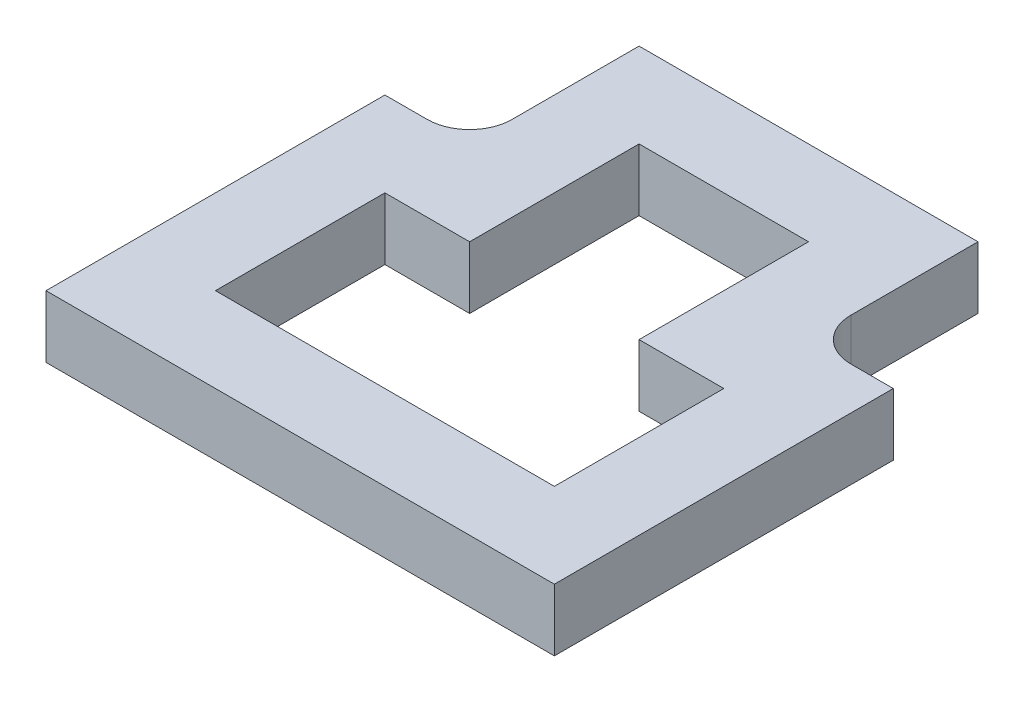
from build123d import *

# Parameters (mm, degrees)
CROQUIS1_W                = 30
CROQUIS1_H                = 30
SALIENTE_EXTRUIR1_DEPTH   = 3
CROQUIS2_W                = 15
CROQUIS2_H                = 30
SALIENTE_EXTRUIR3_DEPTH   = 3
SALIENTE_EXTRUIR3_2_DEPTH = 3
CROQUIS3_W                = 30
CROQUIS3_H                = 30
SALIENTE_EXTRUIR4_DEPTH   = 3
SALIENTE_EXTRUIR5_DEPTH   = 3
CORTAR_EXTRUIR1_DEPTH     = 6
SALIENTE_EXTRUIR8_DEPTH   = 11
CROQUIS7_W                = 30
CROQUIS7_H                = 3.175
CORTAR_EXTRUIR3_DEPTH     = 18.542
CROQUIS9_W                = 60
CROQUIS9_H                = 0.175
SALIENTE_EXTRUIR9_DEPTH   = 11
CROQUIS10_W               = 90
CROQUIS10_H               = 5
CORTAR_EXTRUIR5_DEPTH     = 93
CROQUIS11_W               = 30
CROQUIS11_H               = 3.175
SALIENTE_EXTRUIR10_DEPTH  = 11
CROQUIS12_W               = 60
CROQUIS12_H               = 0.175
CORTAR_EXTRUIR6_DEPTH     = 11
CROQUIS13_W               = 30
CROQUIS13_H               = 5
CORTAR_EXTRUIR7_DEPTH     = 10
SALIENTE_EXTRUIR11_DEPTH  = 5


with BuildPart() as part:
    # Croquis1 → Saliente-Extruir1 (new body)
    with BuildSketch(Plane(origin=(0, 0, 0), x_dir=(1, 0, 0), z_dir=(0, 1, 0))):
        Rectangle(CROQUIS1_W, CROQUIS1_H)
    extrude(amount=SALIENTE_EXTRUIR1_DEPTH)



with BuildPart() as body_2:
    # Croquis2 → Saliente-Extruir3 (new body)
    with BuildSketch(Plane(origin=(0, 3, 0), x_dir=(1, 0, 0), z_dir=(0, 1, 0))):
        with Locations((-22.5, -30)):
            Rectangle(CROQUIS2_W, CROQUIS2_H)
    extrude(amount=-SALIENTE_EXTRUIR3_DEPTH)


with BuildPart() as body_3:
    # Croquis2 → Saliente-Extruir3 2 (new body)
    with BuildSketch(Plane(origin=(0, 3, 0), x_dir=(1, 0, 0), z_dir=(0, 1, 0))):
        with Locations((22.5, -30)):
            Rectangle(CROQUIS2_W, CROQUIS2_H)
    extrude(amount=-SALIENTE_EXTRUIR3_2_DEPTH)


with BuildPart() as part_1:
    add(part.part)

    add(body_2.part)  # Saliente-Extruir4 merges body 2

    add(body_3.part)  # Saliente-Extruir4 merges body 3
    # Croquis3 → Saliente-Extruir4 (add)
    with BuildSketch(Plane(origin=(0, 3, 0), x_dir=(1, 0, 0), z_dir=(0, 1, 0))):
        with Locations((0, -30)):
            Rectangle(CROQUIS3_W, CROQUIS3_H)
    extrude(amount=-SALIENTE_EXTRUIR4_DEPTH)

    # Croquis4 → Saliente-Extruir5 (add)
    with BuildSketch(Plane(origin=(0, 3, 0), x_dir=(1, 0, 0), z_dir=(0, 1, 0))):
        Polygon((-30, 0), (-45, 0), (-45, -60), (45, -60), (45, 0), (30, 0), (30, 30), (-30, 30), align=None)
    extrude(amount=SALIENTE_EXTRUIR5_DEPTH)

    # Croquis5 → Cortar-Extruir1 (cut)
    with BuildSketch(Plane(origin=(0, 0, 0), x_dir=(-1, 0, 0), z_dir=(0, -1, 0))):
        Polygon((30, -45), (30, -15), (15, -15), (15, 15), (-15, 15), (-15, -15), (-30, -15), (-30, -45), align=None)
    extrude(amount=-CORTAR_EXTRUIR1_DEPTH, mode=Mode.SUBTRACT)

    # Croquis6 → Saliente-Extruir8 (add)
    with BuildSketch(Plane(origin=(0, 3, 0), x_dir=(-1, 0, 0), z_dir=(0, -1, 0))):
        with BuildLine():
            Line((37.5, 0), (45, 0))
            Line((45, 0), (45, -60))
            Line((45, -60), (-45, -60))
            Line((-45, -60), (-45, 0))
            Line((-45, 0), (-37.5, 0))
            ThreePointArc((-37.5, 0), (-32.196699141, 2.196699141), (-30, 7.5))
            Line((-30, 7.5), (-30, 30))
            Line((-30, 30), (30, 30))
            Line((30, 30), (30, 7.5))
            ThreePointArc((30, 7.5), (32.196699141, 2.196699141), (37.5, 0))
        make_face()
        Polygon((15, 15), (15, -15), (30, -15), (30, -45), (-30, -45), (-30, -15), (-15, -15), (-15, 15), align=None, mode=Mode.SUBTRACT)
    extrude(amount=-SALIENTE_EXTRUIR8_DEPTH)

    # Croquis7 → Cortar-Extruir3 (cut)
    with BuildSketch(Plane(origin=(0, 14, 0), x_dir=(1, 0, 0), z_dir=(0, 1, 0))):
        with Locations((0, 16.5875)):
            Rectangle(CROQUIS7_W, CROQUIS7_H)
    extrude(amount=-CORTAR_EXTRUIR3_DEPTH, mode=Mode.SUBTRACT)

    # Croquis9 → Saliente-Extruir9 (add)
    with BuildSketch(Plane(origin=(0, 14, 0), x_dir=(1, 0, 0), z_dir=(0, 1, 0))):
        with Locations((0, 30.0875)):
            Rectangle(CROQUIS9_W, CROQUIS9_H)
    extrude(amount=-SALIENTE_EXTRUIR9_DEPTH)

    # Croquis10 → Cortar-Extruir5 (cut)
    with BuildSketch(Plane.XY.offset(60)):
        with Locations((0, 5.5)):
            Rectangle(CROQUIS10_W, CROQUIS10_H)
    extrude(amount=-CORTAR_EXTRUIR5_DEPTH, mode=Mode.SUBTRACT)

    # Croquis11 → Saliente-Extruir10 (add)
    with BuildSketch(Plane(origin=(0, 14, 0), x_dir=(1, 0, 0), z_dir=(0, 1, 0))):
        with Locations((0, 16.5875)):
            Rectangle(CROQUIS11_W, CROQUIS11_H)
    extrude(amount=-SALIENTE_EXTRUIR10_DEPTH)

    # Croquis12 → Cortar-Extruir6 (cut)
    with BuildSketch(Plane(origin=(0, 14, 0), x_dir=(1, 0, 0), z_dir=(0, 1, 0))):
        with Locations((0, 30.0875)):
            Rectangle(CROQUIS12_W, CROQUIS12_H)
    extrude(amount=-CORTAR_EXTRUIR6_DEPTH, mode=Mode.SUBTRACT)

    # Croquis13 → Cortar-Extruir7 (cut)
    with BuildSketch(Plane.XY.offset(-15)):
        with Locations((0, 5.5)):
            Rectangle(CROQUIS13_W, CROQUIS13_H)
    extrude(amount=-CORTAR_EXTRUIR7_DEPTH, mode=Mode.SUBTRACT)

    # Croquis14 → Saliente-Extruir11 (add)
    with BuildSketch(Plane(origin=(0, 14, 0), x_dir=(1, 0, 0), z_dir=(0, 1, 0))):
        with BuildLine():
            Line((-37.5, 0), (-45, 0))
            Line((-45, 0), (-45, -60))
            Line((-45, -60), (45, -60))
            Line((45, -60), (45, 0))
            Line((45, 0), (37.5, 0))
            ThreePointArc((37.5, 0), (32.196699141, 2.196699141), (30, 7.5))
            Line((30, 7.5), (30, 30))
            Line((30, 30), (-30, 30))
            Line((-30, 30), (-30, 7.5))
            ThreePointArc((-30, 7.5), (-32.196699141, 2.196699141), (-37.5, 0))
        make_face()
        Polygon((-15, 15), (-15, -15), (-30, -15), (-30, -45), (30, -45), (30, -15), (15, -15), (15, 15), align=None, mode=Mode.SUBTRACT)
    extrude(amount=SALIENTE_EXTRUIR11_DEPTH)


solid = part_1.part
